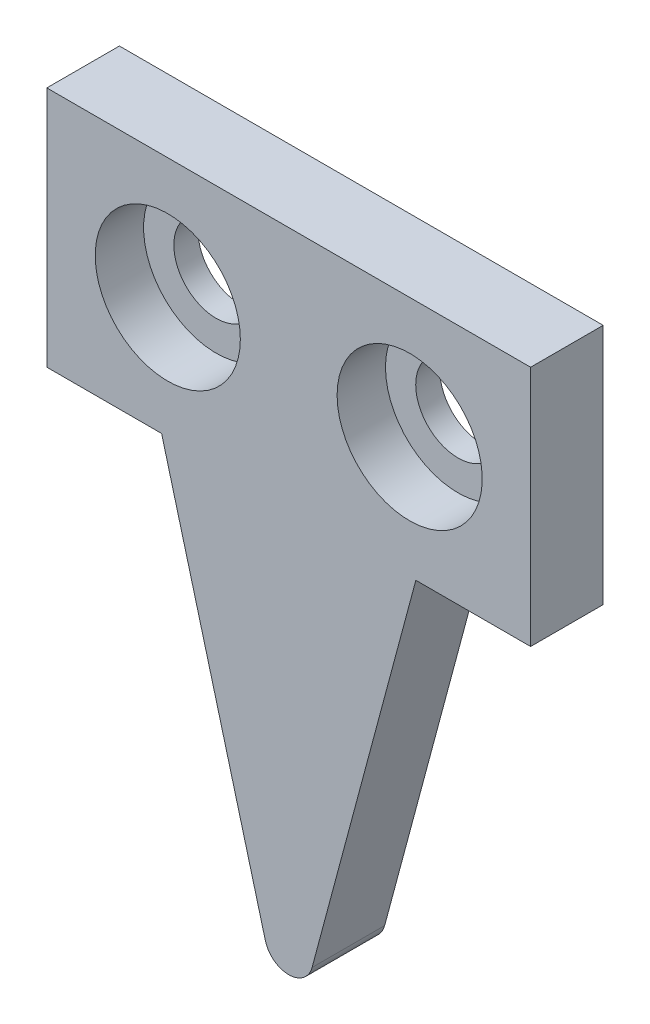
from build123d import *

# Parameters (mm, degrees)
BOSS_EXTRUDE1_DEPTH = 3
SKETCH3_R           = 1.75
CUT_EXTRUDE1_DEPTH  = 3
SKETCH5_R           = 3
CUT_EXTRUDE2_DEPTH  = 2


with BuildPart() as part:
    # Sketch2 → Boss-Extrude1 (new body)
    with BuildSketch(Plane.XY):
        with BuildLine():
            Line((-5.255475961, 15.75), (-0.965925826, -0.258819045))
            ThreePointArc((-0.965925826, -0.258819045), (0, -1), (0.965925826, -0.258819045))
            Line((0.965925826, -0.258819045), (5.255475961, 15.75))
            Line((5.255475961, 15.75), (10, 15.75))
            Line((10, 15.75), (10, 25.75))
            Line((10, 25.75), (-10, 25.75))
            Line((-10, 25.75), (-10, 15.75))
            Line((-10, 15.75), (-5.255475961, 15.75))
        make_face()
    extrude(amount=BOSS_EXTRUDE1_DEPTH)

    # Sketch3 → Cut-Extrude1 (cut)
    with BuildSketch(Plane.XY.offset(3)):
        with Locations((-5, 20.75)):
            Circle(SKETCH3_R)
        with Locations((5, 20.75)):
            Circle(SKETCH3_R)
    extrude(amount=-CUT_EXTRUDE1_DEPTH, mode=Mode.SUBTRACT)

    # Sketch5 → Cut-Extrude2 (cut)
    with BuildSketch(Plane.XY.offset(3)):
        with Locations((-5, 20.75)):
            Circle(SKETCH5_R)
        with Locations(Location((5, 20.75, 0), (0, 0, 180))):
            Circle(SKETCH5_R)
    extrude(amount=-CUT_EXTRUDE2_DEPTH, mode=Mode.SUBTRACT)


solid = part.part
